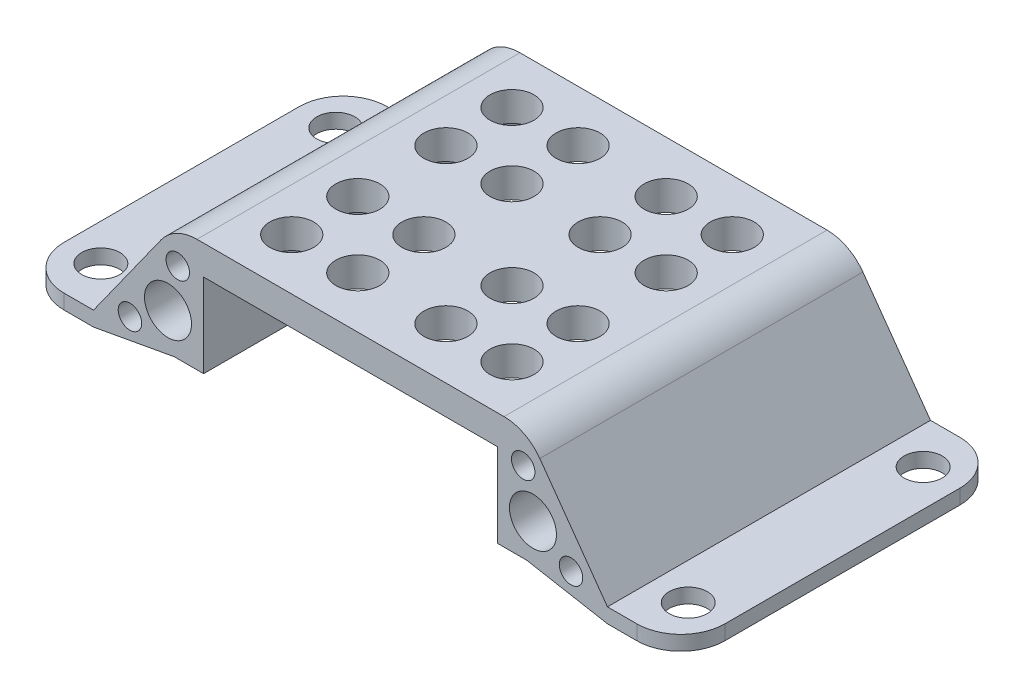
from build123d import *

# Parameters (mm, degrees)
EXTRUDE_1_DEPTH     = 22
SKETCH_5_R          = 1.3
CUT_EXTRUDE_2_DEPTH = 19
FILLET_1_R          = 3
SKETCH_6_R          = 1.5
CUT_EXTRUDE_3_DEPTH = 30
SKETCH_7_R          = 1.6
SKETCH_7_R_2        = 0.8
CUT_EXTRUDE_4_DEPTH = 27
FILLET_2_R          = 3


with BuildPart() as part:
    # 草图1 → 凸台-拉伸1 (new body)
    with BuildSketch(Plane.XY):
        Polygon((0, 12.829776804), (0, 10.829776804), (10, 10.829776804), (10, 5.129776804), (12, 5.129776804), (17.5, 4.129776804), (22.5, 4.129776804), (22.5, 5.129776804), (17.5, 5.129776804), (12, 12.829776804), align=None)
    extrude_1 = extrude(amount=EXTRUDE_1_DEPTH)

    # 镜向1: 凸台-拉伸1 across plane
    add(extrude_1.mirror(Plane(origin=(0, 0, 22), x_dir=(0, 0, 1), z_dir=(1, 0, 0))))

    # 草图5 → 切除-拉伸2 (cut)
    with BuildSketch(Plane(origin=(0, 0, 0), x_dir=(1, 0, 0), z_dir=(0, 1, 0))):
        with Locations((-20, -3)):
            Circle(SKETCH_5_R)
        with Locations((-20, -19)):
            Circle(SKETCH_5_R)
        with Locations(Location((20, -3, 0), (0, 0, 270))):
            Circle(SKETCH_5_R)
        with Locations(Location((20, -19, 0), (0, 0, 270))):
            Circle(SKETCH_5_R)
    extrude(amount=CUT_EXTRUDE_2_DEPTH, mode=Mode.SUBTRACT)

    # 圆角1
    fillet_1_edges = [part.edges().sort_by_distance(p)[0] for p in [
        (22.5, 4.629776804, 0),
        (22.5, 4.629776804, 22),
        (-22.5, 4.629776804, 22),
        (-22.5, 4.629776804, 0),
    ]]
    fillet(fillet_1_edges, radius=FILLET_1_R)

    # 草图6 → 切除-拉伸3 (cut)
    with BuildSketch(Plane(origin=(0, 0, 0), x_dir=(1, 0, 0), z_dir=(0, 1, 0))):
        with Locations(Location((-3, -8, 0), (0, 0, 270))):
            Circle(SKETCH_6_R)
        with Locations(Location((-7.5, -8, 0), (0, 0, 270))):
            Circle(SKETCH_6_R)
        with Locations(Location((-7.5, -3.5, 0), (0, 0, 270))):
            Circle(SKETCH_6_R)
        with Locations(Location((-3, -3.5, 0), (0, 0, 270))):
            Circle(SKETCH_6_R)
        with Locations(Location((-3, -14, 0), (0, 0, 270))):
            Circle(SKETCH_6_R)
        with Locations(Location((-7.5, -14, 0), (0, 0, 270))):
            Circle(SKETCH_6_R)
        with Locations(Location((-3, -18.5, 0), (0, 0, 270))):
            Circle(SKETCH_6_R)
        with Locations(Location((-7.5, -18.5, 0), (0, 0, 270))):
            Circle(SKETCH_6_R)
        with Locations(Location((3, -18.5, 0), (0, 0, 270))):
            Circle(SKETCH_6_R)
        with Locations(Location((7.5, -18.5, 0), (0, 0, 270))):
            Circle(SKETCH_6_R)
        with Locations(Location((3, -14, 0), (0, 0, 270))):
            Circle(SKETCH_6_R)
        with Locations(Location((7.5, -14, 0), (0, 0, 270))):
            Circle(SKETCH_6_R)
        with Locations(Location((3, -8, 0), (0, 0, 270))):
            Circle(SKETCH_6_R)
        with Locations(Location((7.5, -8, 0), (0, 0, 270))):
            Circle(SKETCH_6_R)
        with Locations(Location((3, -3.5, 0), (0, 0, 270))):
            Circle(SKETCH_6_R)
        with Locations(Location((7.5, -3.5, 0), (0, 0, 270))):
            Circle(SKETCH_6_R)
    extrude(amount=CUT_EXTRUDE_3_DEPTH, mode=Mode.SUBTRACT)

    # 草图7 → 切除-拉伸4 (cut)
    with BuildSketch(Plane.XY):
        with Locations((12.426108542, 7.644425741)):
            Circle(SKETCH_7_R)
        with Locations((15.018691649, 5.985664037)):
            Circle(SKETCH_7_R_2)
        with Locations((11.76260386, 10.593335436)):
            Circle(SKETCH_7_R_2)
        with Locations(Location((-11.76260386, 10.593335436, 0), (0, 0, 180))):
            Circle(SKETCH_7_R_2)
        with Locations(Location((-12.426108542, 7.644425741, 0), (0, 0, 180))):
            Circle(SKETCH_7_R)
        with Locations(Location((-15.018691649, 5.985664037, 0), (0, 0, 180))):
            Circle(SKETCH_7_R_2)
    extrude(amount=CUT_EXTRUDE_4_DEPTH, mode=Mode.SUBTRACT)

    # 圆角2
    fillet_2_edges = [part.edges().sort_by_distance(p)[0] for p in [
        (12, 12.829776804, 11),
        (-12, 12.829776804, 11),
    ]]
    fillet(fillet_2_edges, radius=FILLET_2_R)


solid = part.part
